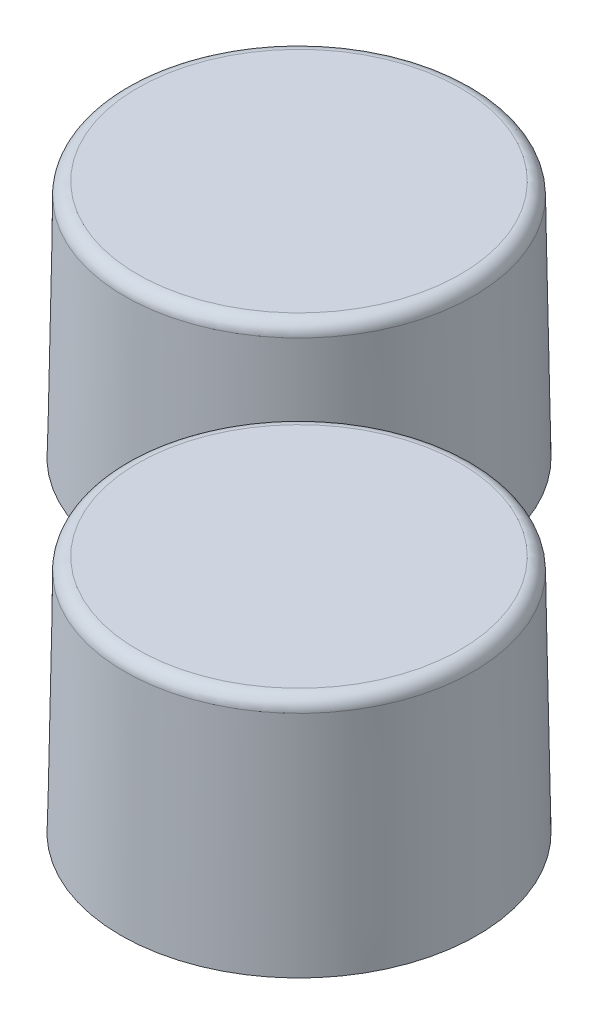
from build123d import *


with BuildPart() as part:
    # Sketch3 → Revolve1 (revolve)
    with BuildSketch(Plane(origin=(173.444343939, 0, -173.444343939), x_dir=(-0.7071067811865471, 0, -0.707106781186548), z_dir=(0.707106781186548, 0, -0.7071067811865471)), mode=Mode.PRIVATE) as revolve1_sk:
        with BuildLine():
            Line((-61.367469068, 128.12049189), (-60.66870568, 168.152619588))
            ThreePointArc((-60.66870568, 168.152619588), (-60.519236464, 168.50051861), (-60.168781832, 168.643893385))
            Line((-60.168781832, 168.643893385), (-31.620159035, 168.643893385))
            Line((-31.620159035, 168.643893385), (-31.620159035, 170.421893385))
            Line((-31.620159035, 170.421893385), (-60.168781832, 170.421893385))
            ThreePointArc((-60.168781832, 170.421893385), (-61.765453136, 169.768677908), (-62.446434882, 168.183649967))
            Line((-62.446434882, 168.183649967), (-63.14519827, 128.151522268))
            Line((-63.14519827, 128.151522268), (-61.367469068, 128.12049189))
        make_face()
    revolve(revolve1_sk.sketch.rotate(Axis((195.803172815, 170.421893385, -151.085515063), (0, 1, 0)), 135), axis=Axis((195.803172815, 170.421893385, -151.085515063), (0, 1, 0)))


with BuildPart() as body_2:
    # Sketch4 → Revolve2 (revolve)
    with BuildSketch(Plane(origin=(173.444343939, 0, -173.444343939), x_dir=(-0.7071067811865471, 0, -0.707106781186548), z_dir=(0.707106781186548, 0, -0.7071067811865471)), mode=Mode.PRIVATE) as revolve2_sk:
        with BuildLine():
            Line((19.924253169, 128.063996333), (20.623271577, 168.152619588))
            ThreePointArc((20.623271577, 168.152619588), (20.772740793, 168.50051861), (21.123195425, 168.643893385))
            Line((21.123195425, 168.643893385), (49.671818222, 168.643893385))
            Line((49.671818222, 168.643893385), (49.671818222, 170.421893385))
            Line((49.671818222, 170.421893385), (21.123195425, 170.421893385))
            ThreePointArc((21.123195425, 170.421893385), (19.526518341, 169.768672228), (18.845542093, 168.183633761))
            Line((18.845542093, 168.183633761), (18.146523402, 128.0949943))
            Line((18.146523402, 128.0949943), (19.924253169, 128.063996333))
        make_face()
    revolve(revolve2_sk.sketch.rotate(Axis((138.32106444, 168.643893385, -208.567623438), (0, 1, 0)), 135), axis=Axis((138.32106444, 168.643893385, -208.567623438), (0, 1, 0)))


solid = Compound([part.part, body_2.part])
